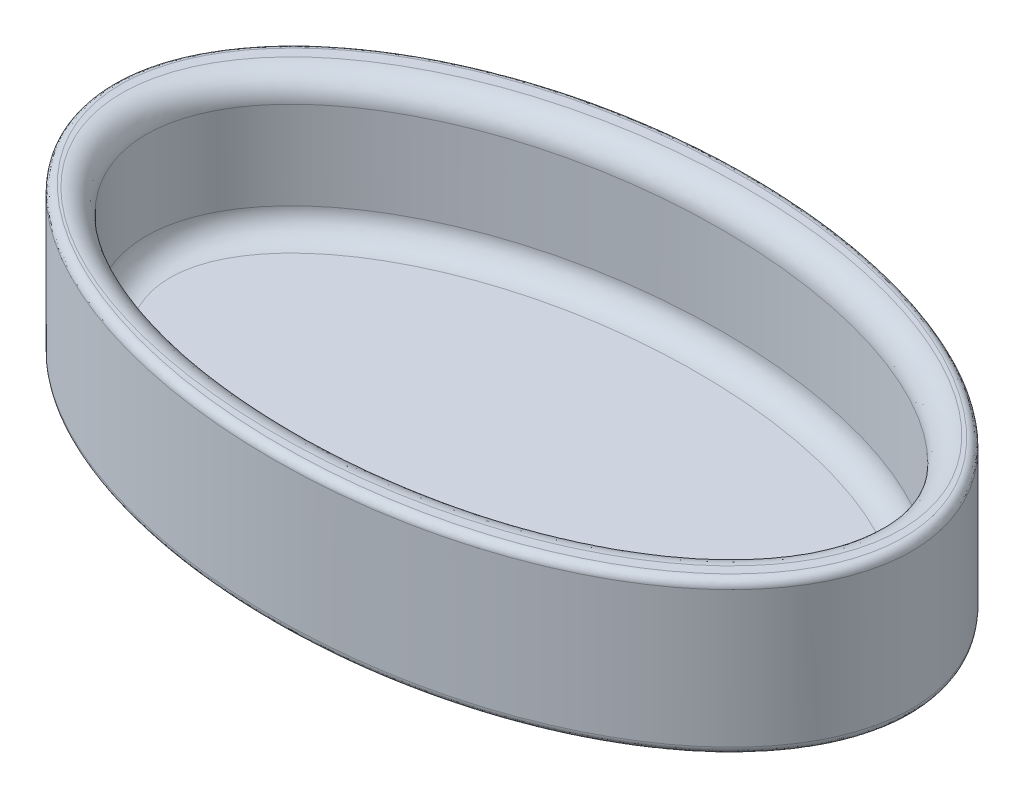
from build123d import *

# Parameters (mm, degrees)
SKETCH2_RX          = 50
SKETCH2_RY          = 30
BOSS_EXTRUDE1_DEPTH = 19.05
SKETCH3_RX          = 45
SKETCH3_RY          = 25
CUT_EXTRUDE1_DEPTH  = 17
FILLET1_R           = 3
FILLET2_R           = 3
FILLET4_R           = 1
FILLET5_R           = 1


with BuildPart() as part:
    # Sketch2 → Boss-Extrude1 (new body)
    with BuildSketch(Plane(origin=(0, 0, 0), x_dir=(1, 0, 0), z_dir=(0, 1, 0))):
        with Locations(Location((50.000067053, 50.081885905), (0, 0, 179.906165623))):
            Ellipse(SKETCH2_RX, SKETCH2_RY)
    extrude(amount=BOSS_EXTRUDE1_DEPTH)

    # Sketch3 → Cut-Extrude1 (cut)
    with BuildSketch(Plane(origin=(0, 19.05, 0), x_dir=(1, 0, 0), z_dir=(0, 1, 0))):
        with Locations(Location((50, 50), (0, 0, 1.266776388))):
            Ellipse(SKETCH3_RX, SKETCH3_RY)
    extrude(amount=-CUT_EXTRUDE1_DEPTH, mode=Mode.SUBTRACT)

    # Fillet1
    fillet1_edges = [part.edges().sort_by_distance(p)[0] for p in [
        (5.013318209, 2.05, -48.913829528),
    ]]
    fillet(fillet1_edges, radius=FILLET1_R)

    # Fillet2
    fillet2_edges = [part.edges().sort_by_distance(p)[0] for p in [
        (5.013318209, 19.05, -48.913829528),
    ]]
    fillet(fillet2_edges, radius=FILLET2_R)

    # Fillet4
    fillet4_edges = [part.edges().sort_by_distance(p)[0] for p in [
        (99.999981674, 19.05, -50.06857837),
    ]]
    fillet(fillet4_edges, radius=FILLET4_R)

    # Fillet5
    fillet5_edges = [part.edges().sort_by_distance(p)[0] for p in [
        (99.999981674, 0, -50.06857837),
    ]]
    fillet(fillet5_edges, radius=FILLET5_R)


solid = part.part
